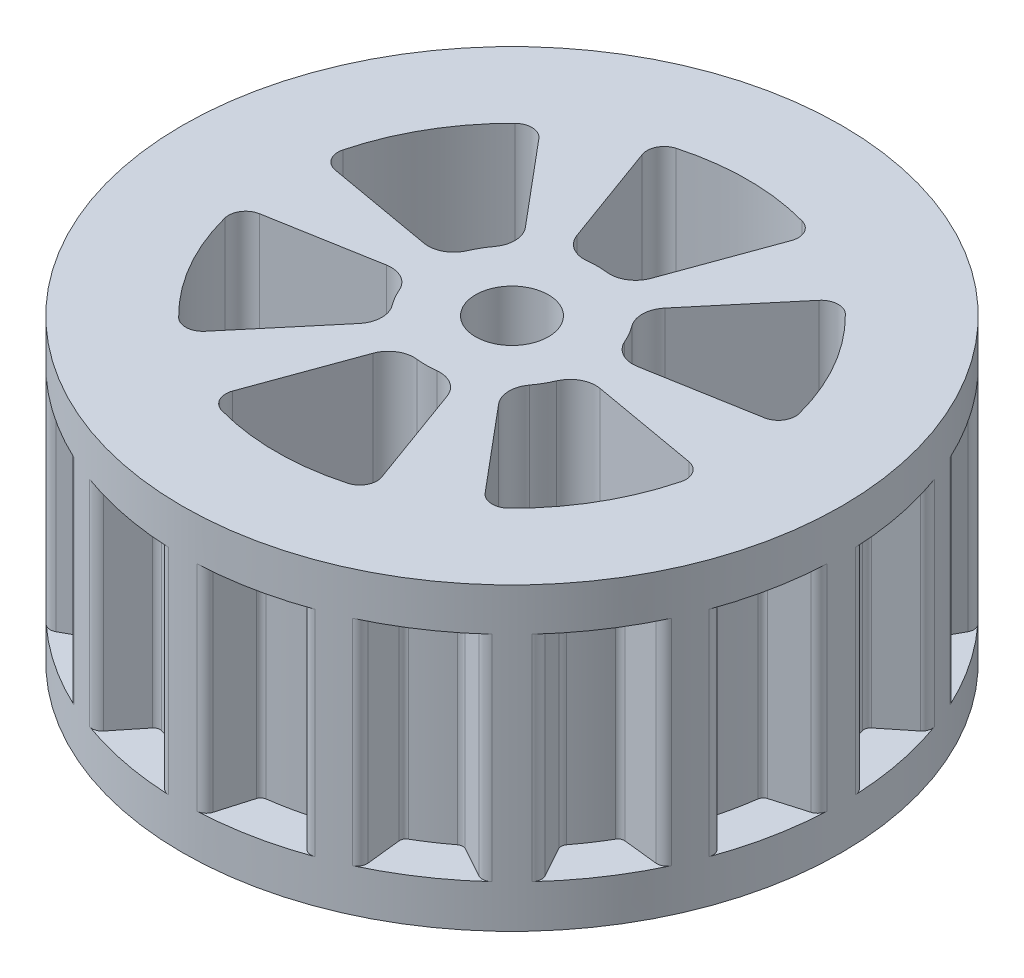
from build123d import *
from build123d.topology import SkipClean

# Parameters (mm, degrees)
SKETCH_1_R          = 76.925
EXTRUDE_1_DEPTH     = 10
EXTRUDE_2_DEPTH     = 50
SKETCH_3_R          = 76.925
EXTRUDE_3_DEPTH     = 10
SKETCH_13_R         = 8.5
CUT_EXTRUDE_5_DEPTH = 130.363484995


with BuildPart() as part:
    # 草图1 → 凸台-拉伸1 (new body)
    with BuildSketch(Plane(origin=(0, 0, 0), x_dir=(1, 0, 0), z_dir=(0, 1, 0))):
        with Locations(Location((0, 0, 0), (0, 0, 270))):
            Circle(SKETCH_1_R)
    extrude(amount=EXTRUDE_1_DEPTH)

    # 草图2 → 凸台-拉伸2 (add)
    with SkipClean():  # the faces are left unmerged after this step: merging them gives an invalid solid
        with BuildSketch(Plane(origin=(0, 10, 0), x_dir=(1, 0, 0), z_dir=(0, 1, 0))):
            with BuildLine():
                Line((5.447555668, 75.199403588), (7.728981055, 67.387415578))
                ThreePointArc((7.728981055, 67.387415578), (8.190482824, 66.670888291), (8.967838365, 66.321440727))
                ThreePointArc((8.967838365, 66.321440727), (13.056419801, 65.639054891), (17.094914261, 64.70486482))
                ThreePointArc((17.094914261, 64.70486482), (17.946824927, 64.730231186), (18.647400087, 65.215607))
                Line((18.647400087, 65.215607), (23.744680693, 71.559879134))
                ThreePointArc((23.744680693, 71.559879134), (24.918986332, 72.334545637), (26.324751361, 72.2804475))
                ThreePointArc((26.324751361, 72.2804475), (29.437923035, 71.069433038), (32.495584374, 69.724404775))
                ThreePointArc((32.495584374, 69.724404775), (33.527863518, 68.76863195), (33.810451061, 67.390500531))
                Line((33.810451061, 67.390500531), (32.928694896, 59.300101002))
                ThreePointArc((32.928694896, 59.300101002), (33.080863813, 58.461507026), (33.665318893, 57.841178488))
                ThreePointArc((33.665318893, 57.841178488), (37.181537845, 55.646103803), (40.555121156, 53.237559796))
                ThreePointArc((40.555121156, 53.237559796), (41.351891272, 52.934983164), (42.184883606, 53.115313438))
                Line((42.184883606, 53.115313438), (49.322004665, 57.026011773))
                ThreePointArc((49.322004665, 57.026011773), (50.703373646, 57.292322987), (51.981428723, 56.704379839))
                ThreePointArc((51.981428723, 56.704379839), (54.394189143, 54.394189143), (56.704379839, 51.981428723))
                ThreePointArc((56.704379839, 51.981428723), (57.292322987, 50.703373646), (57.026011773, 49.322004665))
                Line((57.026011773, 49.322004665), (53.115313438, 42.184883606))
                ThreePointArc((53.115313438, 42.184883606), (52.934983164, 41.351891272), (53.237559796, 40.555121156))
                ThreePointArc((53.237559796, 40.555121156), (55.646103803, 37.181537845), (57.841178488, 33.665318893))
                ThreePointArc((57.841178488, 33.665318893), (58.461507026, 33.080863813), (59.300101002, 32.928694896))
                Line((59.300101002, 32.928694896), (67.390500531, 33.810451061))
                ThreePointArc((67.390500531, 33.810451061), (68.76863195, 33.527863518), (69.724404775, 32.495584374))
                ThreePointArc((69.724404775, 32.495584374), (71.069433038, 29.437923035), (72.2804475, 26.324751361))
                ThreePointArc((72.2804475, 26.324751361), (72.334545637, 24.918986332), (71.559879134, 23.744680693))
                Line((71.559879134, 23.744680693), (65.215607, 18.647400087))
                ThreePointArc((65.215607, 18.647400087), (64.730231186, 17.946824927), (64.70486482, 17.094914261))
                ThreePointArc((64.70486482, 17.094914261), (65.639054891, 13.056419801), (66.321440727, 8.967838365))
                ThreePointArc((66.321440727, 8.967838365), (66.670888291, 8.190482824), (67.387415578, 7.728981055))
                Line((67.387415578, 7.728981055), (75.199403588, 5.447555668))
                ThreePointArc((75.199403588, 5.447555668), (76.364489428, 4.65909076), (76.852472253, 3.339630761))
                ThreePointArc((76.852472253, 3.339630761), (76.925, 0), (76.852472253, -3.339630761))
                ThreePointArc((76.852472253, -3.339630761), (76.364489428, -4.65909076), (75.199403588, -5.447555668))
                Line((75.199403588, -5.447555668), (67.387415578, -7.728981055))
                ThreePointArc((67.387415578, -7.728981055), (66.670888291, -8.190482824), (66.321440727, -8.967838365))
                ThreePointArc((66.321440727, -8.967838365), (65.639054891, -13.056419801), (64.70486482, -17.094914261))
                ThreePointArc((64.70486482, -17.094914261), (64.730231186, -17.946824927), (65.215607, -18.647400087))
                Line((65.215607, -18.647400087), (71.559879134, -23.744680693))
                ThreePointArc((71.559879134, -23.744680693), (72.334545637, -24.918986332), (72.2804475, -26.324751361))
                ThreePointArc((72.2804475, -26.324751361), (71.069433038, -29.437923035), (69.724404775, -32.495584374))
                ThreePointArc((69.724404775, -32.495584374), (68.76863195, -33.527863518), (67.390500531, -33.810451061))
                Line((67.390500531, -33.810451061), (59.300101002, -32.928694896))
                ThreePointArc((59.300101002, -32.928694896), (58.461507026, -33.080863813), (57.841178488, -33.665318893))
                ThreePointArc((57.841178488, -33.665318893), (55.646103803, -37.181537845), (53.237559796, -40.555121156))
                ThreePointArc((53.237559796, -40.555121156), (52.934983164, -41.351891272), (53.115313438, -42.184883606))
                Line((53.115313438, -42.184883606), (57.026011773, -49.322004665))
                ThreePointArc((57.026011773, -49.322004665), (57.292322987, -50.703373646), (56.704379839, -51.981428723))
                ThreePointArc((56.704379839, -51.981428723), (54.394189143, -54.394189143), (51.981428723, -56.704379839))
                ThreePointArc((51.981428723, -56.704379839), (50.703373646, -57.292322987), (49.322004665, -57.026011773))
                Line((49.322004665, -57.026011773), (42.184883606, -53.115313438))
                ThreePointArc((42.184883606, -53.115313438), (41.351891272, -52.934983164), (40.555121156, -53.237559796))
                ThreePointArc((40.555121156, -53.237559796), (37.181537845, -55.646103803), (33.665318893, -57.841178488))
                ThreePointArc((33.665318893, -57.841178488), (33.080863813, -58.461507026), (32.928694896, -59.300101002))
                Line((32.928694896, -59.300101002), (33.810451061, -67.390500531))
                ThreePointArc((33.810451061, -67.390500531), (33.527863518, -68.76863195), (32.495584374, -69.724404775))
                ThreePointArc((32.495584374, -69.724404775), (29.437923035, -71.069433038), (26.324751361, -72.2804475))
                ThreePointArc((26.324751361, -72.2804475), (24.918986332, -72.334545637), (23.744680693, -71.559879134))
                Line((23.744680693, -71.559879134), (18.647400087, -65.215607))
                ThreePointArc((18.647400087, -65.215607), (17.946824927, -64.730231186), (17.094914261, -64.70486482))
                ThreePointArc((17.094914261, -64.70486482), (13.056419801, -65.639054891), (8.967838365, -66.321440727))
                ThreePointArc((8.967838365, -66.321440727), (8.190482824, -66.670888291), (7.728981055, -67.387415578))
                Line((7.728981055, -67.387415578), (5.447555668, -75.199403588))
                ThreePointArc((5.447555668, -75.199403588), (4.65909076, -76.364489428), (3.339630761, -76.852472253))
                ThreePointArc((3.339630761, -76.852472253), (0, -76.925), (-3.339630761, -76.852472253))
                ThreePointArc((-3.339630761, -76.852472253), (-4.65909076, -76.364489428), (-5.447555668, -75.199403588))
                Line((-5.447555668, -75.199403588), (-7.728981055, -67.387415578))
                ThreePointArc((-7.728981055, -67.387415578), (-8.190482824, -66.670888291), (-8.967838365, -66.321440727))
                ThreePointArc((-8.967838365, -66.321440727), (-13.056419801, -65.639054891), (-17.094914261, -64.70486482))
                ThreePointArc((-17.094914261, -64.70486482), (-17.946824927, -64.730231186), (-18.647400087, -65.215607))
                Line((-18.647400087, -65.215607), (-23.744680693, -71.559879134))
                ThreePointArc((-23.744680693, -71.559879134), (-24.918986332, -72.334545637), (-26.324751361, -72.2804475))
                ThreePointArc((-26.324751361, -72.2804475), (-29.437923035, -71.069433038), (-32.495584374, -69.724404775))
                ThreePointArc((-32.495584374, -69.724404775), (-33.527863518, -68.76863195), (-33.810451061, -67.390500531))
                Line((-33.810451061, -67.390500531), (-32.928694896, -59.300101002))
                ThreePointArc((-32.928694896, -59.300101002), (-33.080863813, -58.461507026), (-33.665318893, -57.841178488))
                ThreePointArc((-33.665318893, -57.841178488), (-37.181537845, -55.646103803), (-40.555121156, -53.237559796))
                ThreePointArc((-40.555121156, -53.237559796), (-41.351891272, -52.934983164), (-42.184883606, -53.115313438))
                Line((-42.184883606, -53.115313438), (-49.322004665, -57.026011773))
                ThreePointArc((-49.322004665, -57.026011773), (-50.703373646, -57.292322987), (-51.981428723, -56.704379839))
                ThreePointArc((-51.981428723, -56.704379839), (-54.394189143, -54.394189143), (-56.704379839, -51.981428723))
                ThreePointArc((-56.704379839, -51.981428723), (-57.292322987, -50.703373646), (-57.026011773, -49.322004665))
                Line((-57.026011773, -49.322004665), (-53.115313438, -42.184883606))
                ThreePointArc((-53.115313438, -42.184883606), (-52.934983164, -41.351891272), (-53.237559796, -40.555121156))
                ThreePointArc((-53.237559796, -40.555121156), (-55.646103803, -37.181537845), (-57.841178488, -33.665318893))
                ThreePointArc((-57.841178488, -33.665318893), (-58.461507026, -33.080863812), (-59.300101002, -32.928694896))
                Line((-59.300101002, -32.928694896), (-67.390500531, -33.810451061))
                ThreePointArc((-67.390500531, -33.810451061), (-68.76863195, -33.527863518), (-69.724404775, -32.495584374))
                ThreePointArc((-69.724404775, -32.495584374), (-71.069433038, -29.437923035), (-72.2804475, -26.324751361))
                ThreePointArc((-72.2804475, -26.324751361), (-72.334545637, -24.918986332), (-71.559879134, -23.744680693))
                Line((-71.559879134, -23.744680693), (-65.215607, -18.647400087))
                ThreePointArc((-65.215607, -18.647400087), (-64.730231186, -17.946824927), (-64.70486482, -17.094914261))
                ThreePointArc((-64.70486482, -17.094914261), (-65.639054891, -13.056419801), (-66.321440727, -8.967838365))
                ThreePointArc((-66.321440727, -8.967838365), (-66.670888291, -8.190482824), (-67.387415578, -7.728981055))
                Line((-67.387415578, -7.728981055), (-75.199403588, -5.447555668))
                ThreePointArc((-75.199403588, -5.447555668), (-76.364489428, -4.65909076), (-76.852472253, -3.339630761))
                ThreePointArc((-76.852472253, -3.339630761), (-76.925, 0), (-76.852472253, 3.339630761))
                ThreePointArc((-76.852472253, 3.339630761), (-76.364489428, 4.65909076), (-75.199403588, 5.447555668))
                Line((-75.199403588, 5.447555668), (-67.387415578, 7.728981055))
                ThreePointArc((-67.387415578, 7.728981055), (-66.670888291, 8.190482824), (-66.321440727, 8.967838365))
                ThreePointArc((-66.321440727, 8.967838365), (-65.639054891, 13.056419801), (-64.70486482, 17.094914261))
                ThreePointArc((-64.70486482, 17.094914261), (-64.730231186, 17.946824927), (-65.215607, 18.647400087))
                Line((-65.215607, 18.647400087), (-71.559879134, 23.744680693))
                ThreePointArc((-71.559879134, 23.744680693), (-72.334545637, 24.918986332), (-72.2804475, 26.324751361))
                ThreePointArc((-72.2804475, 26.324751361), (-71.069433038, 29.437923035), (-69.724404775, 32.495584374))
                ThreePointArc((-69.724404775, 32.495584374), (-68.76863195, 33.527863518), (-67.390500531, 33.810451061))
                Line((-67.390500531, 33.810451061), (-59.300101002, 32.928694896))
                ThreePointArc((-59.300101002, 32.928694896), (-58.461507026, 33.080863813), (-57.841178488, 33.665318893))
                ThreePointArc((-57.841178488, 33.665318893), (-55.646103803, 37.181537845), (-53.237559796, 40.555121156))
                ThreePointArc((-53.237559796, 40.555121156), (-52.934983164, 41.351891272), (-53.115313438, 42.184883606))
                Line((-53.115313438, 42.184883606), (-57.026011773, 49.322004665))
                ThreePointArc((-57.026011773, 49.322004665), (-57.292322987, 50.703373646), (-56.704379839, 51.981428723))
                ThreePointArc((-56.704379839, 51.981428723), (-54.394189143, 54.394189143), (-51.981428723, 56.704379839))
                ThreePointArc((-51.981428723, 56.704379839), (-50.703373646, 57.292322987), (-49.322004665, 57.026011773))
                Line((-49.322004665, 57.026011773), (-42.184883606, 53.115313438))
                ThreePointArc((-42.184883606, 53.115313438), (-41.351891272, 52.934983164), (-40.555121156, 53.237559796))
                ThreePointArc((-40.555121156, 53.237559796), (-37.181537845, 55.646103803), (-33.665318893, 57.841178488))
                ThreePointArc((-33.665318893, 57.841178488), (-33.080863812, 58.461507026), (-32.928694896, 59.300101002))
                Line((-32.928694896, 59.300101002), (-33.810451061, 67.390500531))
                ThreePointArc((-33.810451061, 67.390500531), (-33.527863518, 68.76863195), (-32.495584374, 69.724404775))
                ThreePointArc((-32.495584374, 69.724404775), (-29.437923035, 71.069433038), (-26.324751361, 72.2804475))
                ThreePointArc((-26.324751361, 72.2804475), (-24.918986332, 72.334545637), (-23.744680693, 71.559879134))
                Line((-23.744680693, 71.559879134), (-18.647400087, 65.215607))
                ThreePointArc((-18.647400087, 65.215607), (-17.946824927, 64.730231186), (-17.094914261, 64.70486482))
                ThreePointArc((-17.094914261, 64.70486482), (-13.056419801, 65.639054891), (-8.967838365, 66.321440727))
                ThreePointArc((-8.967838365, 66.321440727), (-8.190482824, 66.670888291), (-7.728981055, 67.387415578))
                Line((-7.728981055, 67.387415578), (-5.447555668, 75.199403588))
                ThreePointArc((-5.447555668, 75.199403588), (-4.65909076, 76.364489428), (-3.339630761, 76.852472253))
                ThreePointArc((-3.339630761, 76.852472253), (0, 76.925), (3.339630761, 76.852472253))
                ThreePointArc((3.339630761, 76.852472253), (4.65909076, 76.364489428), (5.447555668, 75.199403588))
            make_face()
        extrude(amount=EXTRUDE_2_DEPTH)

    # 草图3 → 凸台-拉伸3 (add)
    with SkipClean():  # the faces are left unmerged after this step: merging them gives an invalid solid
        with BuildSketch(Plane(origin=(0, 60, 0), x_dir=(1, 0, 0), z_dir=(0, 1, 0))):
            with Locations(Location((0, 0, 0), (0, 0, 270))):
                Circle(SKETCH_3_R)
        extrude(amount=EXTRUDE_3_DEPTH)

    # 草图13 → 切除-拉伸5 (cut, through all)
    with SkipClean():  # the faces are left unmerged after this step: merging them gives an invalid solid
        with BuildSketch(Plane(origin=(0, 0, 0), x_dir=(1, 0, 0), z_dir=(0, 1, 0))):
            with BuildLine():
                ThreePointArc((38.548918614, 39.229846721), (35.553392828, 40.372157836), (32.681183124, 38.947917398))
                Line((32.681183124, 38.947917398), (16.261383187, 19.379561833))
                ThreePointArc((16.261383187, 19.379561833), (14.860201916, 15.697817121), (16.044346035, 11.940643212))
                ThreePointArc((16.044346035, 11.940643212), (17.320508076, 10), (18.363073376, 7.924489648))
                ThreePointArc((18.363073376, 7.924489648), (21.024809369, 5.020403804), (24.913884455, 4.392990024))
                Line((24.913884455, 4.392990024), (50.070477453, 8.828776112))
                ThreePointArc((50.070477453, 8.828776112), (52.740010706, 10.604062462), (53.248503153, 13.769419447))
                ThreePointArc((53.248503153, 13.769419447), (47.631397208, 27.5), (38.548918614, 39.229846721))
            make_face()
            with BuildLine():
                Line((8.652501269, 23.772551857), (17.389294329, 47.77669351))
                ThreePointArc((17.389294329, 47.77669351), (17.186617878, 50.976220298), (14.69958454, 52.999266168))
                ThreePointArc((14.69958454, 52.999266168), (0, 55), (-14.69958454, 52.999266168))
                ThreePointArc((-14.69958454, 52.999266168), (-17.186617878, 50.976220298), (-17.389294329, 47.77669351))
                Line((-17.389294329, 47.77669351), (-8.652501269, 23.772551857))
                ThreePointArc((-8.652501269, 23.772551857), (-6.164607453, 20.718220925), (-2.318727341, 19.865132859))
                ThreePointArc((-2.318727341, 19.865132859), (0, 20), (2.318727341, 19.865132859))
                ThreePointArc((2.318727341, 19.865132859), (6.164607453, 20.718220925), (8.652501269, 23.772551857))
            make_face()
            with BuildLine():
                ThreePointArc((-53.248503153, 13.769419447), (-52.740010706, 10.604062462), (-50.070477453, 8.828776112))
                Line((-50.070477453, 8.828776112), (-24.913884455, 4.392990024))
                ThreePointArc((-24.913884455, 4.392990024), (-21.024809369, 5.020403804), (-18.363073376, 7.924489648))
                ThreePointArc((-18.363073376, 7.924489648), (-17.320508076, 10), (-16.044346035, 11.940643212))
                ThreePointArc((-16.044346035, 11.940643212), (-14.860201916, 15.697817121), (-16.261383187, 19.379561833))
                Line((-16.261383187, 19.379561833), (-32.681183124, 38.947917398))
                ThreePointArc((-32.681183124, 38.947917398), (-35.553392828, 40.372157836), (-38.548918614, 39.229846721))
                ThreePointArc((-38.548918614, 39.229846721), (-47.631397208, 27.5), (-53.248503153, 13.769419447))
            make_face()
            with BuildLine():
                ThreePointArc((-38.548918614, -39.229846721), (-35.553392828, -40.372157836), (-32.681183124, -38.947917398))
                Line((-32.681183124, -38.947917398), (-16.261383187, -19.379561833))
                ThreePointArc((-16.261383187, -19.379561833), (-14.860201916, -15.697817121), (-16.044346035, -11.940643212))
                ThreePointArc((-16.044346035, -11.940643212), (-17.320508076, -10), (-18.363073376, -7.924489648))
                ThreePointArc((-18.363073376, -7.924489648), (-21.024809369, -5.020403804), (-24.913884455, -4.392990024))
                Line((-24.913884455, -4.392990024), (-50.070477453, -8.828776112))
                ThreePointArc((-50.070477453, -8.828776112), (-52.740010706, -10.604062462), (-53.248503153, -13.769419447))
                ThreePointArc((-53.248503153, -13.769419447), (-47.631397208, -27.5), (-38.548918614, -39.229846721))
            make_face()
            with BuildLine():
                ThreePointArc((14.69958454, -52.999266168), (17.186617878, -50.976220298), (17.389294329, -47.77669351))
                Line((17.389294329, -47.77669351), (8.652501269, -23.772551857))
                ThreePointArc((8.652501269, -23.772551857), (6.164607453, -20.718220925), (2.318727341, -19.865132859))
                ThreePointArc((2.318727341, -19.865132859), (0, -20), (-2.318727341, -19.865132859))
                ThreePointArc((-2.318727341, -19.865132859), (-6.164607453, -20.718220925), (-8.652501269, -23.772551857))
                Line((-8.652501269, -23.772551857), (-17.389294329, -47.77669351))
                ThreePointArc((-17.389294329, -47.77669351), (-17.186617878, -50.976220298), (-14.69958454, -52.999266168))
                ThreePointArc((-14.69958454, -52.999266168), (0, -55), (14.69958454, -52.999266168))
            make_face()
            with BuildLine():
                ThreePointArc((53.248503153, -13.769419447), (52.740010706, -10.604062462), (50.070477453, -8.828776112))
                Line((50.070477453, -8.828776112), (24.913884455, -4.392990024))
                ThreePointArc((24.913884455, -4.392990024), (21.024809369, -5.020403804), (18.363073376, -7.924489648))
                ThreePointArc((18.363073376, -7.924489648), (17.320508076, -10), (16.044346035, -11.940643212))
                ThreePointArc((16.044346035, -11.940643212), (14.860201916, -15.697817121), (16.261383187, -19.379561833))
                Line((16.261383187, -19.379561833), (32.681183124, -38.947917398))
                ThreePointArc((32.681183124, -38.947917398), (35.553392828, -40.372157836), (38.548918614, -39.229846721))
                ThreePointArc((38.548918614, -39.229846721), (47.631397208, -27.5), (53.248503153, -13.769419447))
            make_face()
            with Locations(Location((0, 0, 0), (0, 0, 270))):
                Circle(SKETCH_13_R)
        extrude(amount=CUT_EXTRUDE_5_DEPTH, mode=Mode.SUBTRACT)


solid = part.part
